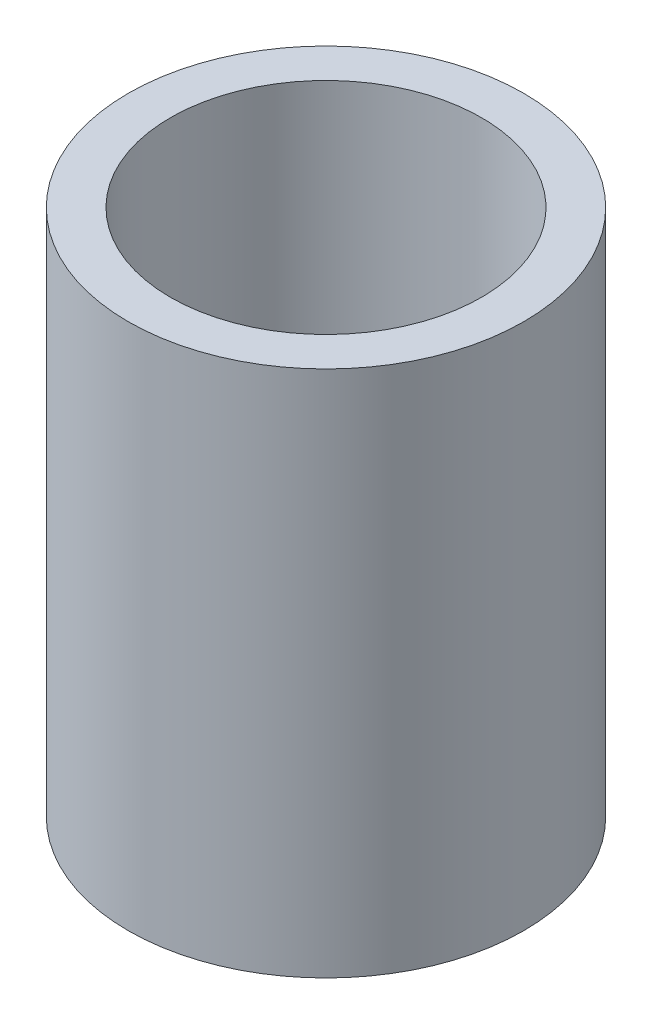
from build123d import *

# Parameters (mm, degrees)
SKETCH1_R           = 1.905
SKETCH1_R_2         = 1.4986
BOSS_EXTRUDE1_DEPTH = 5.08


with BuildPart() as part:
    # Sketch1 → Boss-Extrude1 (new body)
    with BuildSketch(Plane(origin=(0, 0, 0), x_dir=(1, 0, 0), z_dir=(0, 1, 0))):
        with Locations(Location((0, 0, 0), (0, 0, 270))):
            Circle(SKETCH1_R)
        with Locations(Location((0, 0, 0), (0, 0, 270))):
            Circle(SKETCH1_R_2, mode=Mode.SUBTRACT)
    extrude(amount=BOSS_EXTRUDE1_DEPTH)


solid = part.part
